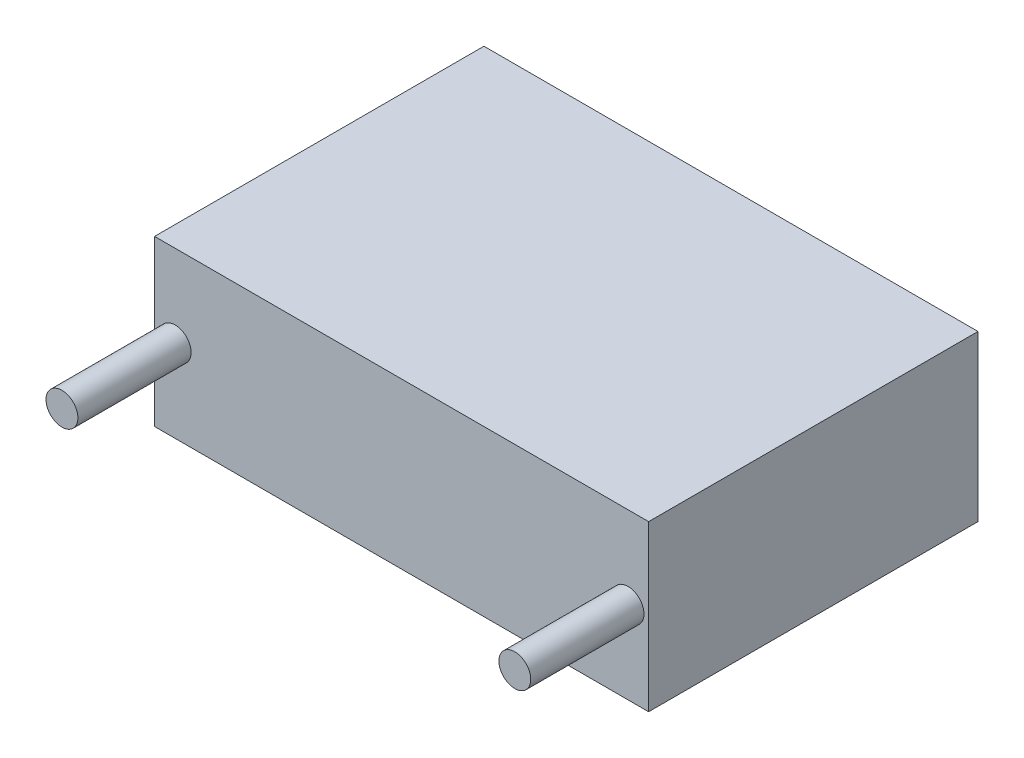
from build123d import *

# Parameters (mm, degrees)
SKETCH_1_W      = 24
SKETCH_1_H      = 8
EXTRUDE_1_DEPTH = 16
SKETCH_2_R      = 0.77457148
EXTRUDE_2_DEPTH = 5.5


with BuildPart() as part:
    # Эскиз1 → Вытянуть1 (new body)
    with BuildSketch(Plane.XY):
        with Locations((12, 4)):
            Rectangle(SKETCH_1_W, SKETCH_1_H)
    extrude(amount=EXTRUDE_1_DEPTH)

    # Эскиз2 → Вытянуть2 (add)
    with BuildSketch(Plane.XY.offset(16)):
        with Locations(Location((1, 4, 0), (0, 0, 180))):
            Circle(SKETCH_2_R)
        with Locations(Location((23, 4, 0), (0, 0, 180))):
            Circle(SKETCH_2_R)
    extrude(amount=EXTRUDE_2_DEPTH)


solid = part.part
